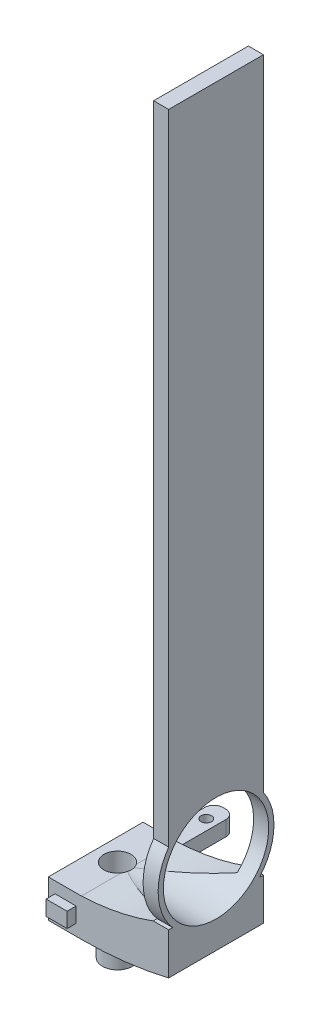
from build123d import *

# Parameters (mm, degrees)
BOSS_EXTRUDE1_DEPTH      = 48
SKETCH2_W                = 14
SKETCH2_H                = 10
BOSS_EXTRUDE2_DEPTH      = 50
FILLET1_R                = 6
SKETCH7_R                = 38.5
SKETCH7_R_2              = 35
BOSS_EXTRUDE3_DEPTH      = 10
SKETCH8_R                = 35
CUT_EXTRUDE2_DEPTH       = 90
BOSS_EXTRUDE4_DEPTH      = 5
BOSS_EXTRUDE4_DEPTH_BACK = 10
SKETCH10_R               = 12
SKETCH10_R_2             = 9
BOSS_EXTRUDE5_START      = 25
SKETCH11_R               = 10
SKETCH11_R_2             = 9
BOSS_EXTRUDE5_DEPTH      = 25
SKETCH12_R               = 9
CUT_EXTRUDE3_DEPTH       = 42
BOSS_EXTRUDE6_DEPTH      = 7.5
BOSS_EXTRUDE7_START      = 7.5
BOSS_EXTRUDE7_DEPTH      = 7.5
FILLET1_OF_MIRROR1_R     = 6
SKETCH15_W               = 14
SKETCH15_H               = 10
CUT_EXTRUDE4_DEPTH       = 101
BOSS_EXTRUDE8_DEPTH      = 10


with BuildPart() as part:
    # Sketch1 → Boss-Extrude1 (new body)
    with BuildSketch(Plane.XY):
        with BuildLine():
            Line((0, 0), (0, 25.00039893))
            Line((0, 25.00039893), (22, 25.00039893))
            ThreePointArc((22, 25.00039893), (51.667114877, 29.062120939), (80, 38.751440389))
            Line((80, 38.751440389), (80, 6.798665084))
            ThreePointArc((80, 6.798665084), (51.198552391, 1.705464917), (22, 0))
            Line((22, 0), (0, 0))
        make_face()
    extrude(amount=BOSS_EXTRUDE1_DEPTH)

    # Sketch2 → Boss-Extrude2 (add)
    with BuildSketch(Plane.XY.offset(48)):
        with Locations((11.5, 12.5)):
            Rectangle(SKETCH2_W, SKETCH2_H)
    boss_extrude2 = extrude(amount=BOSS_EXTRUDE2_DEPTH)

    # Sketch5 → M8x1.0 Tapped Hole1 (revolve, cut)
    with BuildSketch(Plane(origin=(11.5, 17.5, 86), x_dir=(0, 0, 1), z_dir=(1, 0, 0))):
        Polygon((0, 0), (0, 12.103012167), (3.5, 10), (3.5, 0), align=None)
    m8x1_0_tapped_hole1 = revolve(axis=Axis((11.5, 23.85, 86), (0, -1, 0)), mode=Mode.SUBTRACT)

    # Fillet1
    fillet1_edges = [part.edges().sort_by_distance(p)[0] for p in [
        (18.5, 12.5, 98),
        (4.5, 12.5, 98),
    ]]
    fillet(fillet1_edges, radius=FILLET1_R)

    # Sketch7 → Boss-Extrude3 (add)
    with BuildSketch(Plane.ZY.offset(-80)):
        with Locations((24, 60.00039893)):
            Circle(SKETCH7_R)
        with Locations((24, 60.00039893)):
            Circle(SKETCH7_R_2, mode=Mode.SUBTRACT)
    extrude(amount=BOSS_EXTRUDE3_DEPTH)

    # Sketch8 → Cut-Extrude2 (cut)
    with BuildSketch(Plane.ZY.offset(-80)):
        with Locations(Location((24, 60.00039893, 0), (0, 0, 226.708192407))):
            Circle(SKETCH8_R)
    extrude(amount=CUT_EXTRUDE2_DEPTH, mode=Mode.SUBTRACT)

    # Sketch10 → Boss-Extrude4 (add, two sides: drawn at the far end of the back side and taken through both)
    with BuildSketch(Plane.XZ.offset(-BOSS_EXTRUDE4_DEPTH_BACK)):
        with Locations((14.5, 24)):
            Circle(SKETCH10_R)
        with Locations((14.5, 24)):
            Circle(SKETCH10_R_2, mode=Mode.SUBTRACT)
    extrude(amount=BOSS_EXTRUDE4_DEPTH + BOSS_EXTRUDE4_DEPTH_BACK)

    # Sketch11 → Boss-Extrude5 (add)
    with BuildSketch(Plane.XZ.offset(5).offset(BOSS_EXTRUDE5_START)):
        with Locations((14.5, 24)):
            Circle(SKETCH11_R)
        with Locations((14.5, 24)):
            Circle(SKETCH11_R_2, mode=Mode.SUBTRACT)
    extrude(amount=-BOSS_EXTRUDE5_DEPTH)

    # Sketch12 → Cut-Extrude3 (cut)
    with BuildSketch(Plane(origin=(0, 0, 0), x_dir=(-1, 0, 0), z_dir=(0, -1, 0))):
        with Locations(Location((-14.5, -24, 0), (0, 0, 180))):
            Circle(SKETCH12_R)
    extrude(amount=-CUT_EXTRUDE3_DEPTH, mode=Mode.SUBTRACT)

    # Sketch13 → Boss-Extrude6 (add)
    with BuildSketch(Plane.XY.offset(48)):
        with BuildLine():
            Line((0, 25.00039893), (0, 0))
            Line((0, 0), (22, 0))
            ThreePointArc((22, 0), (51.198552391, 1.705464917), (80, 6.798665084))
            Line((80, 6.798665084), (80, 29.896412483))
            Line((80, 29.896412483), (80, 34.524920524))
            Line((80, 34.524920524), (70, 34.524920524))
            Line((70, 34.524920524), (69.729925021, 34.524920524))
            ThreePointArc((69.729925021, 34.524920524), (46.24106465, 27.877911315), (22, 25.00039893))
            Line((22, 25.00039893), (0, 25.00039893))
        make_face()
    extrude(amount=BOSS_EXTRUDE6_DEPTH)

    # Sketch14 → Boss-Extrude7 (add)
    with BuildSketch(Plane(origin=(0, 0, 0), x_dir=(-1, 0, 0), z_dir=(0, 0, -1)).offset(BOSS_EXTRUDE7_START)):
        with BuildLine():
            Line((-80, 29.896412483), (-80, 6.798665084))
            ThreePointArc((-80, 6.798665084), (-51.198552391, 1.705464917), (-22, 0))
            Line((-22, 0), (0, 0))
            Line((0, 0), (0, 25.00039893))
            Line((0, 25.00039893), (-22, 25.00039893))
            ThreePointArc((-22, 25.00039893), (-46.24106465, 27.877911315), (-69.729925021, 34.524920524))
            Line((-69.729925021, 34.524920524), (-70, 34.524920524))
            Line((-70, 34.524920524), (-80, 34.524920524))
            Line((-80, 34.524920524), (-80, 29.896412483))
        make_face()
    extrude(amount=-BOSS_EXTRUDE7_DEPTH)

    # Mirror1: Boss-Extrude2, M8x1.0 Tapped Hole1 across plane
    add(boss_extrude2.mirror(Plane.XY.offset(24)))
    add(m8x1_0_tapped_hole1.mirror(Plane.XY.offset(24)), mode=Mode.SUBTRACT)

    # Fillet1 of Mirror1
    fillet1_of_mirror1_edges = [part.edges().sort_by_distance(p)[0] for p in [
        (18.5, 12.5, -50),
        (4.5, 12.5, -50),
    ]]
    fillet(fillet1_of_mirror1_edges, radius=FILLET1_OF_MIRROR1_R)

    # Sketch15 → Cut-Extrude4 (cut)
    with BuildSketch(Plane.XY.offset(61.5)):
        with Locations((11.5, 12.5)):
            Rectangle(SKETCH15_W, SKETCH15_H)
    extrude(amount=CUT_EXTRUDE4_DEPTH, mode=Mode.SUBTRACT)

    # Sketch16 → Boss-Extrude8 (add)
    with BuildSketch(Plane(origin=(80, 0, 0), x_dir=(0, 0, -1), z_dir=(1, 0, 0))):
        with BuildLine():
            Line((-55.5, 75.256545232), (-55.5, 506.798665084))
            Line((-55.5, 506.798665084), (7.5, 506.798665084))
            Line((7.5, 506.798665084), (7.5, 75.256545232))
            ThreePointArc((7.5, 75.256545232), (-24, 95.00039893), (-55.5, 75.256545232))
        make_face()
    extrude(amount=-BOSS_EXTRUDE8_DEPTH)


solid = part.part
